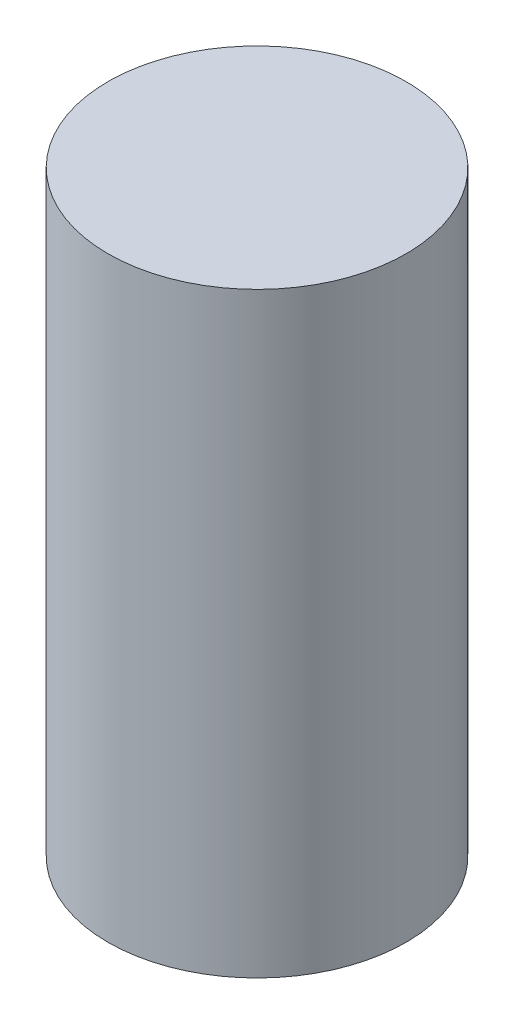
from build123d import *

# Parameters (mm, degrees)
SKETCH_1_R      = 100
EXTRUDE_1_DEPTH = 400


with BuildPart() as part:
    # 草图1 → 凸台-拉伸1 (new body)
    with BuildSketch(Plane(origin=(0, 0, 0), x_dir=(1, 0, 0), z_dir=(0, 1, 0))):
        with Locations(Location((0, 0, 0), (0, 0, 270))):
            Circle(SKETCH_1_R)
    extrude(amount=EXTRUDE_1_DEPTH)


solid = part.part
